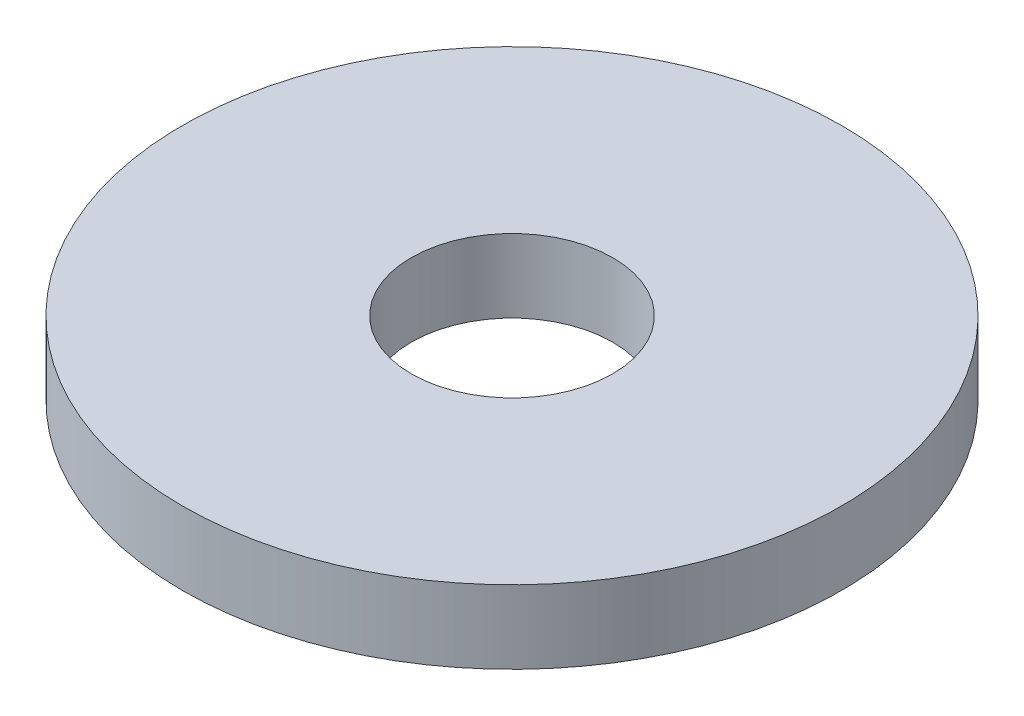
from build123d import *

# Parameters (mm, degrees)
SKETCH1_R          = 9
BASE_EXTRUDE_DEPTH = 2
SKETCH2_R          = 2.75
TYPE_R_DEPTH       = 13.884098727


with BuildPart() as part:
    # Sketch1 → Base-Extrude (new body)
    with BuildSketch(Plane(origin=(0, 0, 0), x_dir=(1, 0, 0), z_dir=(0, 1, 0))):
        with Locations(Location((0, 0, 0), (0, 0, 270))):
            Circle(SKETCH1_R)
    extrude(amount=-BASE_EXTRUDE_DEPTH)

    # Sketch2 → Type-R (cut, through all)
    with BuildSketch(Plane(origin=(0, 0, 0), x_dir=(-1, 0, 0), z_dir=(0, 1, 0))):
        with Locations(Location((0, 0, 0), (0, 0, 90))):
            Circle(SKETCH2_R)
    extrude(amount=-TYPE_R_DEPTH, mode=Mode.SUBTRACT)


solid = part.part
